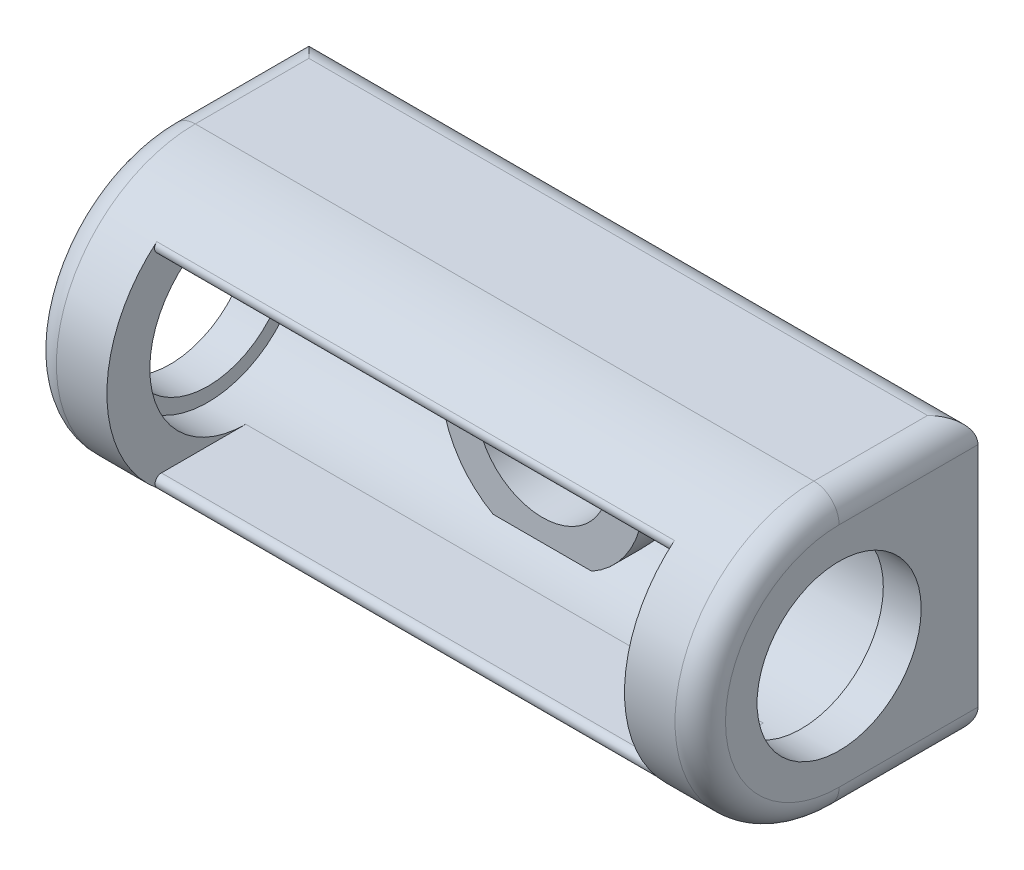
from build123d import *
from build123d.topology import SkipClean

# Parameters (mm, degrees)
BOSS_EXTRUDE1_DEPTH = 26.5
CUT_EXTRUDE2_REACH  = 38.729
CUT_EXTRUDE2_START  = -6
CUT_EXTRUDE3_REACH  = 32.729
SKETCH4_R           = 6.5
CUT_EXTRUDE6_START  = -3
SKETCH7_R           = 7.6000000000000005
CUT_EXTRUDE6_DEPTH  = 3
BOSS_EXTRUDE4_REACH = 60.236
BOSS_EXTRUDE4_START = -3
SKETCH8_R           = 7.999999999999998
CUT_EXTRUDE4_START  = -11
SKETCH5_R           = 5.2499999999999964
CUT_EXTRUDE4_DEPTH  = 8
FILLET1_R           = 2
FILLET2_R           = 0.5


with BuildPart() as part:
    # Sketch1 → Boss-Extrude1 (new body)
    with BuildSketch(Plane(origin=(0, 0, 0), x_dir=(0, 0, -1), z_dir=(1, 0, 0))):
        with BuildLine():
            Line((0, 11), (11.000000000000002, 11))
            Line((11.000000000000002, 11), (11.000000000000002, -11))
            Line((11.000000000000002, -11), (3.47e-15, -11))
            ThreePointArc((3.47e-15, -11), (-11, 1.35e-15), (0, 11))
        make_face()
    boss_extrude1 = extrude(amount=BOSS_EXTRUDE1_DEPTH)

    # Sketch3 → Cut-Extrude2 (cut, up to next)
    with BuildSketch(Plane.ZY.offset(CUT_EXTRUDE2_START), mode=Mode.PRIVATE) as cut_extrude2_sk1:
        with BuildLine():
            Line((0.7418695651929484, 7.5637047502028025), (10.999999999999998, 7.5637047502028025))
            Line((10.999999999999998, 7.5637047502028025), (11, -7.599999999999998))
            Line((11, -7.599999999999998), (9.3e-16, -7.6))
            ThreePointArc((9.3e-16, -7.6), (-7.590920764358606, 0.3713784447559566), (0.7418695651929484, 7.5637047502028025))
        make_face()
    cut_extrude2_tool1 = extrude(cut_extrude2_sk1.sketch, amount=-CUT_EXTRUDE2_REACH, mode=Mode.PRIVATE) & part.part
    cut_extrude2 = cut_extrude2_tool1.solids().sort_by_distance((6, -0.011225, 2.425795))[0]
    add(cut_extrude2, mode=Mode.SUBTRACT)

    # Sketch4 → Cut-Extrude3 (cut, up to next)
    with BuildSketch(Plane.ZY, mode=Mode.PRIVATE) as cut_extrude3_sk1:
        Circle(SKETCH4_R)
    cut_extrude3_tool1 = extrude(cut_extrude3_sk1.sketch, amount=-CUT_EXTRUDE3_REACH, mode=Mode.PRIVATE) & part.part
    cut_extrude3 = cut_extrude3_tool1.solids().sort_by_distance((0, 0, 0))[0]
    add(cut_extrude3, mode=Mode.SUBTRACT)

    # Sketch7 → Cut-Extrude6 (cut)
    with BuildSketch(Plane(origin=(6, 0, 0), x_dir=(0, 0, -1), z_dir=(1, 0, 0)).offset(CUT_EXTRUDE6_START)):
        with Locations(Location((0, 0, 0), (0, 0, 95.601814437))):
            Circle(SKETCH7_R)
    cut_extrude6 = extrude(amount=CUT_EXTRUDE6_DEPTH, mode=Mode.SUBTRACT)

    # Mirror1: Boss-Extrude1, Cut-Extrude2, Cut-Extrude3, Cut-Extrude6 across plane
    with SkipClean():  # the faces are left unmerged after this step: merging them gives an invalid solid
        add(boss_extrude1.mirror(Plane(origin=(26.5, 0, 0), x_dir=(0, 0, 1), z_dir=(1, 0, 0))))
        add(cut_extrude2.mirror(Plane(origin=(26.5, 0, 0), x_dir=(0, 0, 1), z_dir=(1, 0, 0))), mode=Mode.SUBTRACT)
        add(cut_extrude3.mirror(Plane(origin=(26.5, 0, 0), x_dir=(0, 0, 1), z_dir=(1, 0, 0))), mode=Mode.SUBTRACT)
        add(cut_extrude6.mirror(Plane(origin=(26.5, 0, 0), x_dir=(0, 0, 1), z_dir=(1, 0, 0))), mode=Mode.SUBTRACT)

    # Sketch8 → Boss-Extrude4 (add, up to next)
    with BuildSketch(Plane.XY.offset(BOSS_EXTRUDE4_START), mode=Mode.PRIVATE) as boss_extrude4_sk1:
        with Locations((26.499999999999996, 3.1e-16)):
            Circle(SKETCH8_R)
    boss_extrude4_tool1 = extrude(boss_extrude4_sk1.sketch, amount=-BOSS_EXTRUDE4_REACH, mode=Mode.PRIVATE) - part.part
    add(boss_extrude4_tool1.solids().sort_by_distance((26.5, 0, -3))[0])

    # Sketch5 → Cut-Extrude4 (cut)
    with SkipClean():  # the faces are left unmerged after this step: merging them gives an invalid solid
        with BuildSketch(Plane.XY.offset(CUT_EXTRUDE4_START)):
            with Locations((26.499999999999996, 3.1e-16)):
                Circle(SKETCH5_R)
        extrude(amount=CUT_EXTRUDE4_DEPTH, mode=Mode.SUBTRACT)

    # Fillet1
    fillet1_edges = [part.edges().sort_by_distance(p)[0] for p in [
        (53, -11, -5.500000000000003),
        (53, 11, -5.500000000000001),
        (53, -1.7e-15, 11),
        (0, -1.7e-15, 11),
        (0, 11, -5.500000000000001),
        (0, -11, -5.500000000000003),
        (26.5, 11, -11.000000000000002),
        (26.5, -11, -11.000000000000002),
    ]]
    fillet(fillet1_edges, radius=FILLET1_R)

    # Fillet2
    fillet2_edges = [part.edges().sort_by_distance(p)[0] for p in [
        (26.5, -7.599999999999999, 7.9523581408284185),
        (26.5, 7.5637047502028025, 7.9868874069789895),
    ]]
    fillet(fillet2_edges, radius=FILLET2_R)


solid = part.part
